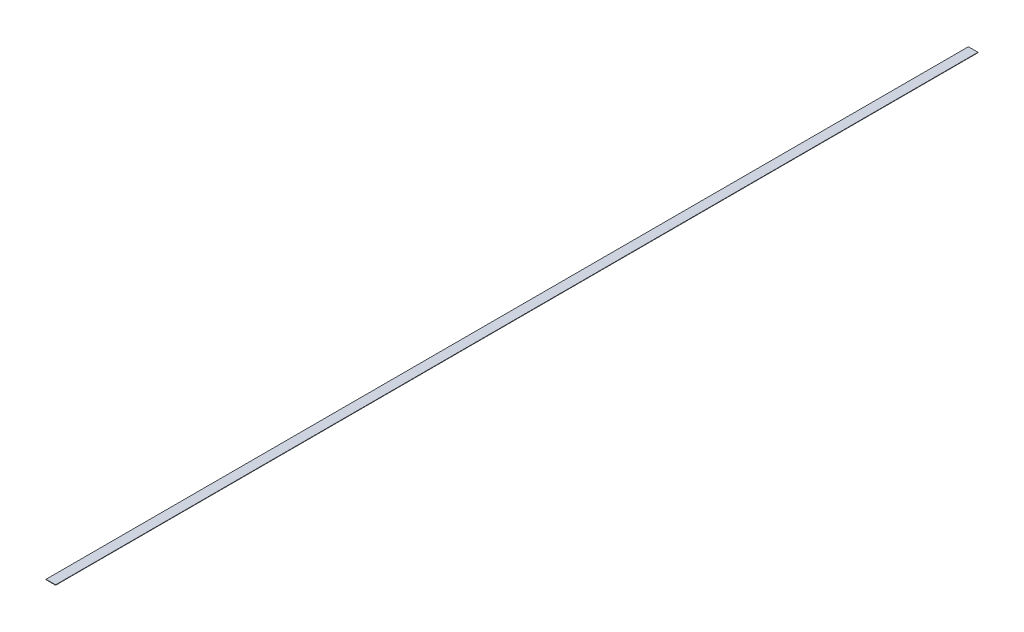
from build123d import *

# Parameters (mm, degrees)
SKETCH1_W           = 19.05
SKETCH1_H           = 1828.8
EXTRUDE_THIN1_DEPTH = 0.79375


with BuildPart() as part:
    # Sketch1 → Extrude-Thin1 (new body)
    with BuildSketch(Plane(origin=(0, 0, 0), x_dir=(1, 0, 0), z_dir=(0, 1, 0))):
        Rectangle(SKETCH1_W, SKETCH1_H)
    extrude(amount=EXTRUDE_THIN1_DEPTH)


solid = part.part
